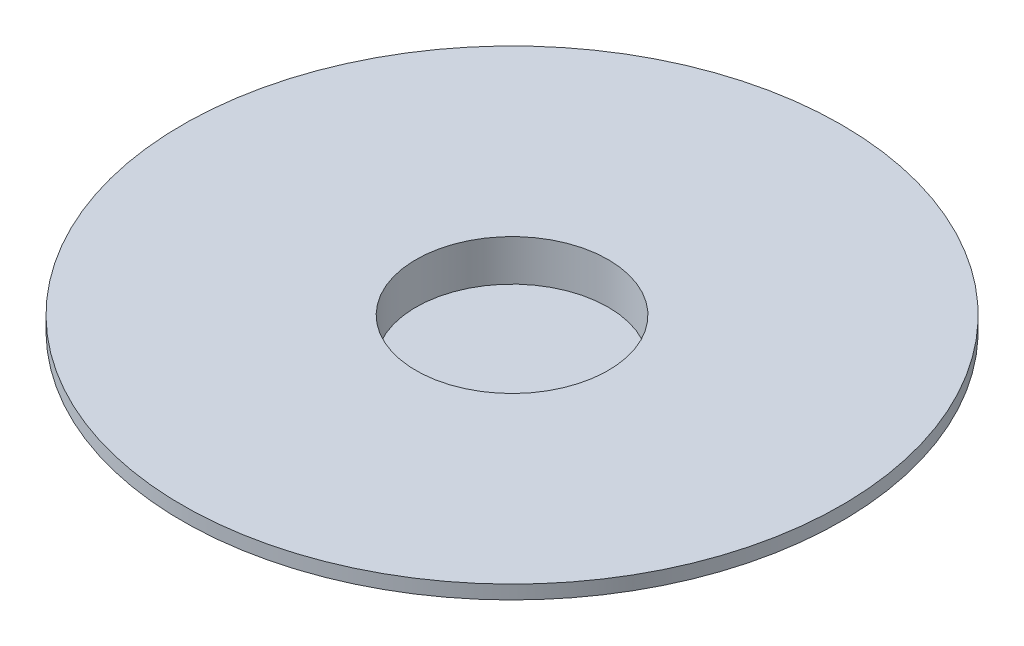
from build123d import *

# Parameters (mm, degrees)
CUT_EXTRUDE_START   = -20
SKETCH_2_R          = 35
CUT_EXTRUDE_1_DEPTH = 20


with BuildPart() as part:
    # Эскиз1 → Повернуть1 (revolve)
    with BuildSketch(Plane.XY, mode=Mode.PRIVATE) as revolve_1_sk:
        Polygon((0, 0), (-35, 0), (-35, 15), (-120, 15), (-120, 10), (-40, 10), (-40, -30), (0, -30), align=None)
    revolve(revolve_1_sk.sketch.rotate(Axis((0, -30, 0), (0, 1, 0)), 270), axis=Axis((0, -30, 0), (0, 1, 0)))

    # Эскиз2 → Вырез-Вытянуть1 (cut)
    with BuildSketch(Plane.XZ.offset(30).offset(CUT_EXTRUDE_START)):
        with Locations(Location((0, 0, 0), (0, 0, 270))):
            Circle(SKETCH_2_R)
    extrude(amount=CUT_EXTRUDE_1_DEPTH, mode=Mode.SUBTRACT)


solid = part.part
